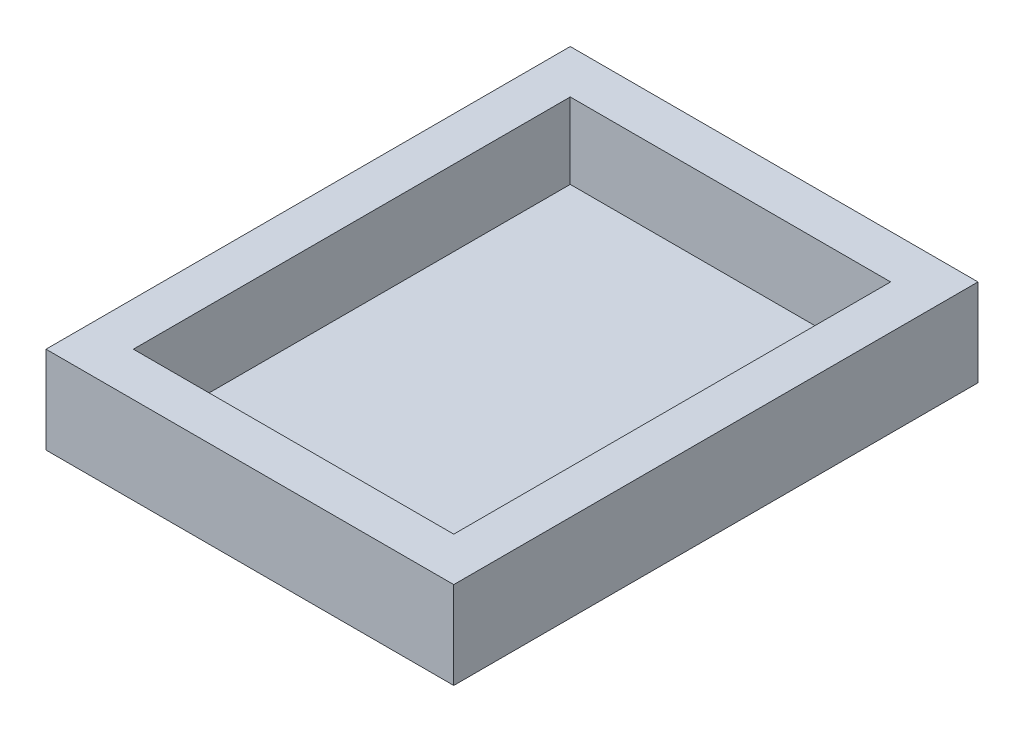
from build123d import *

# Parameters (mm, degrees)
SKETCH1_W           = 70
SKETCH1_H           = 90
BOSS_EXTRUDE1_DEPTH = 15
SKETCH2_W           = 55
SKETCH2_H           = 75
CUT_EXTRUDE1_DEPTH  = 13


with BuildPart() as part:
    # Sketch1 → Boss-Extrude1 (new body)
    with BuildSketch(Plane(origin=(0, 0, 0), x_dir=(1, 0, 0), z_dir=(0, 1, 0))):
        Rectangle(SKETCH1_W, SKETCH1_H)
    extrude(amount=BOSS_EXTRUDE1_DEPTH)

    # Sketch2 → Cut-Extrude1 (cut)
    with BuildSketch(Plane(origin=(0, 15, 0), x_dir=(1, 0, 0), z_dir=(0, 1, 0))):
        Rectangle(SKETCH2_W, SKETCH2_H)
    extrude(amount=-CUT_EXTRUDE1_DEPTH, mode=Mode.SUBTRACT)


solid = part.part
